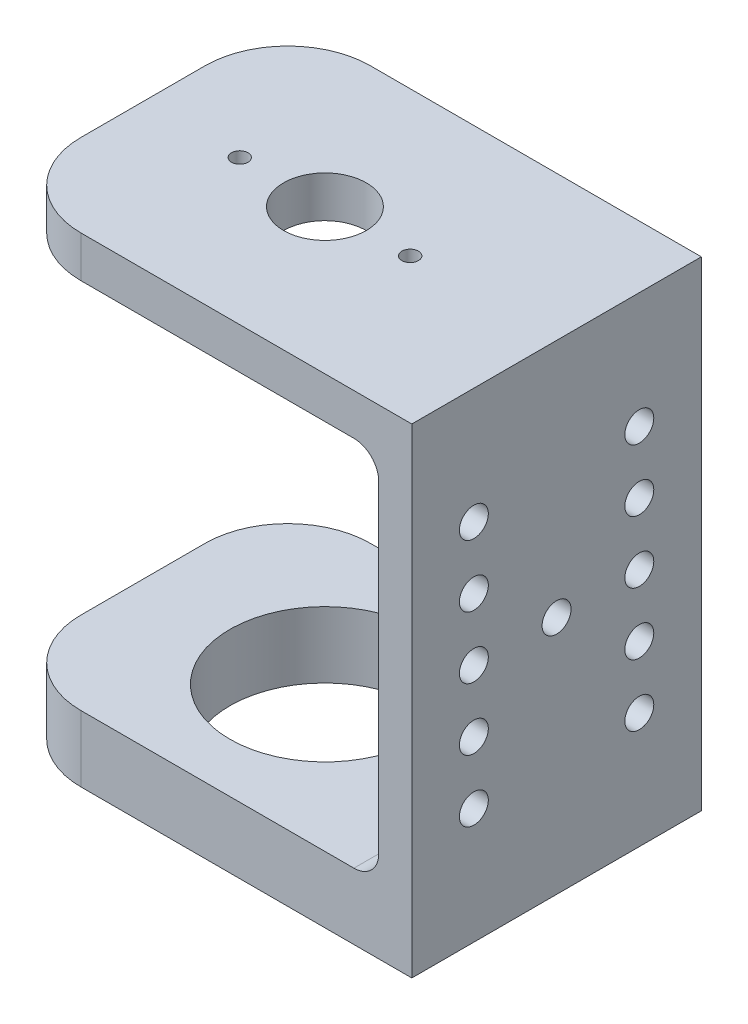
from build123d import *

# Parameters (mm, degrees)
SKETCH1_W           = 50
SKETCH1_H           = 35
SKETCH1_R           = 11.5
BOSS_EXTRUDE1_DEPTH = 8
SKETCH2_W           = 4
SKETCH2_H           = 35
BOSS_EXTRUDE2_DEPTH = 45
SKETCH3_W           = 50
SKETCH3_H           = 35
SKETCH3_R           = 5
SKETCH3_R_2         = 1
BOSS_EXTRUDE3_DEPTH = 5
FILLET1_R           = 10
FILLET2_R           = 3
SKETCH4_R           = 1.75
CUT_EXTRUDE1_DEPTH  = 79.550938887


with BuildPart() as part:
    # Sketch1 → Boss-Extrude1 (new body)
    with BuildSketch(Plane(origin=(0, 0, 0), x_dir=(1, 0, 0), z_dir=(0, 1, 0))):
        with Locations((3, 0)):
            Rectangle(SKETCH1_W, SKETCH1_H)
        Circle(SKETCH1_R, mode=Mode.SUBTRACT)
    extrude(amount=BOSS_EXTRUDE1_DEPTH)

    # Sketch2 → Boss-Extrude2 (add)
    with BuildSketch(Plane(origin=(0, 8, 0), x_dir=(1, 0, 0), z_dir=(0, 1, 0))):
        with Locations((26, 0)):
            Rectangle(SKETCH2_W, SKETCH2_H)
    extrude(amount=BOSS_EXTRUDE2_DEPTH)

    # Sketch3 → Boss-Extrude3 (add)
    with BuildSketch(Plane(origin=(0, 53, 0), x_dir=(1, 0, 0), z_dir=(0, 1, 0))):
        with Locations((3, 0)):
            Rectangle(SKETCH3_W, SKETCH3_H)
        Circle(SKETCH3_R, mode=Mode.SUBTRACT)
        with Locations((10.3, 0)):
            Circle(SKETCH3_R_2, mode=Mode.SUBTRACT)
        with Locations((-10.3, 0)):
            Circle(SKETCH3_R_2, mode=Mode.SUBTRACT)
    extrude(amount=BOSS_EXTRUDE3_DEPTH)

    # Fillet1
    fillet1_edges = [part.edges().sort_by_distance(p)[0] for p in [
        (-22, 55.5, 17.5),
        (-22, 55.5, -17.5),
        (-22, 4, -17.5),
        (-22, 4, 17.5),
    ]]
    fillet(fillet1_edges, radius=FILLET1_R)

    # Fillet2
    fillet2_edges = [part.edges().sort_by_distance(p)[0] for p in [
        (24, 53, 0),
        (24, 8, 0),
    ]]
    fillet(fillet2_edges, radius=FILLET2_R)

    # Sketch4 → Cut-Extrude1 (cut, through all)
    with BuildSketch(Plane(origin=(28, 0, 0), x_dir=(0, 0, -1), z_dir=(1, 0, 0))):
        with Locations((0, 29)):
            Circle(SKETCH4_R)
        with Locations((-10, 36.5)):
            Circle(SKETCH4_R)
        with Locations((10, 21.5)):
            Circle(SKETCH4_R)
        with Locations((-10, 44)):
            Circle(SKETCH4_R)
        with Locations((-10, 14)):
            Circle(SKETCH4_R)
        with Locations((10, 14)):
            Circle(SKETCH4_R)
        with Locations((-10, 29)):
            Circle(SKETCH4_R)
        with Locations((10, 29)):
            Circle(SKETCH4_R)
        with Locations((-10, 21.5)):
            Circle(SKETCH4_R)
        with Locations((10, 36.5)):
            Circle(SKETCH4_R)
        with Locations((10, 44)):
            Circle(SKETCH4_R)
    extrude(amount=-CUT_EXTRUDE1_DEPTH, mode=Mode.SUBTRACT)


solid = part.part
